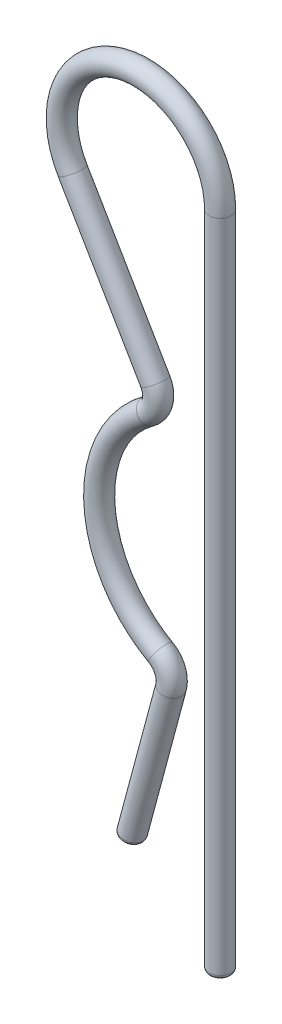
from build123d import *

# Parameters (mm, degrees)
SKETCH2_R = 2.5
FILLET1_R = 1


with BuildPart() as part:
    # Sweep1: sweep along a path in Sketch1
    with BuildLine(Plane.XY) as sweep1_path:
        Line((0, -80), (0, 70))
        ThreePointArc((0, 70), (-22.712119009, 87.372274878), (-33.532881605, 60.904419258))
        Line((-33.532881605, 60.904419258), (-14.757917224, 28.841672836))
        ThreePointArc((-14.757917224, 28.841672836), (-14.179292041, 25.28776046), (-16.138359396, 22.266642226))
        ThreePointArc((-16.138359396, 22.266642226), (-27.456326157, -1.549243036), (-13.53107327, -23.940761395))
        ThreePointArc((-13.53107327, -23.940761395), (-11.380690743, -26.359053874), (-11.161639279, -29.587722328))
        Line((-11.161639279, -29.587722328), (-20.220305857, -63.395126248))
    # Sketch2 → Sweep1 (sweep)
    with BuildSketch(Plane(origin=(0, -80, 0), x_dir=(1, 0, 0), z_dir=(0, 1, 0))):
        Circle(SKETCH2_R)
    sweep(path=sweep1_path.line)

    # Fillet1
    fillet1_edges = [part.edges().sort_by_distance(p)[0] for p in [
        (-17.805491292, -64.042173861, 0),
        (-2.5, -80, 0),
    ]]
    fillet(fillet1_edges, radius=FILLET1_R)


solid = part.part
